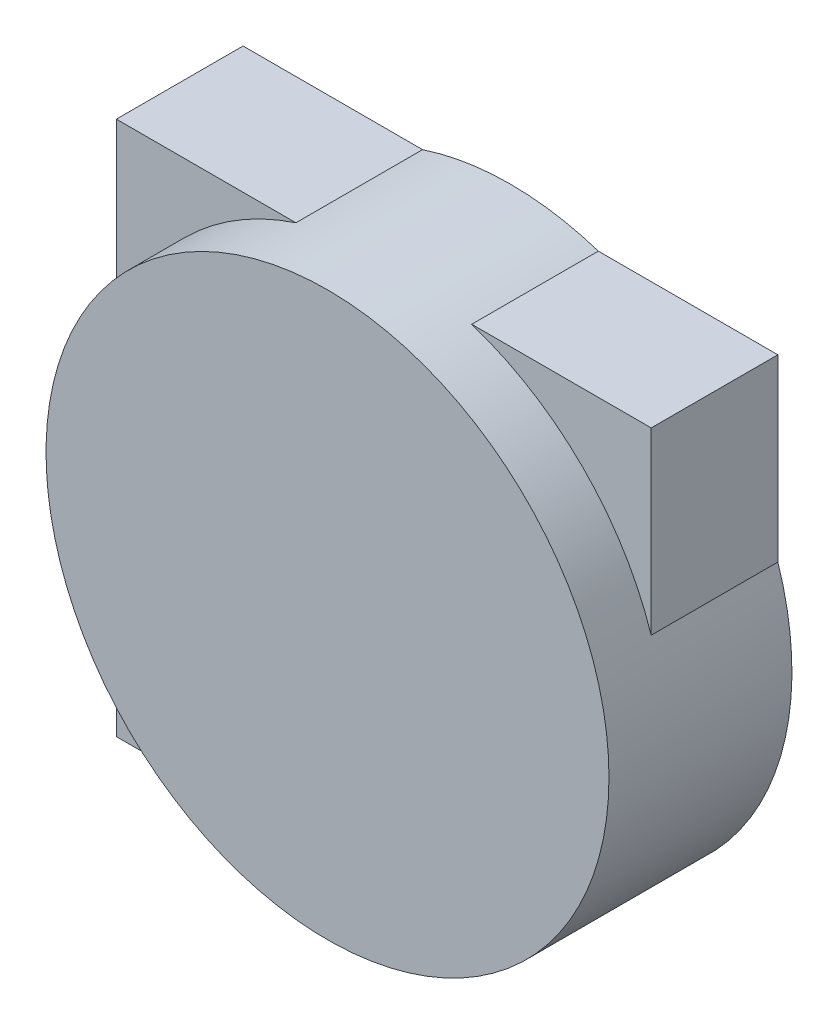
from build123d import *

# Parameters (mm, degrees)
SKETCH1_R           = 20
BOSS_EXTRUDE1_DEPTH = 13
BOSS_EXTRUDE2_DEPTH = 9


with BuildPart() as part:
    # Sketch1 → Boss-Extrude1 (new body)
    with BuildSketch(Plane.XY):
        with Locations(Location((0, 0, 0), (0, 0, 180))):
            Circle(SKETCH1_R)
    extrude(amount=BOSS_EXTRUDE1_DEPTH)

    # Sketch2 → Boss-Extrude2 (add)
    with BuildSketch(Plane(origin=(0, 0, 0), x_dir=(-1, 0, 0), z_dir=(0, 0, -1))):
        with BuildLine():
            Line((-19, 19), (19, 19))
            Line((19, 19), (19, -19))
            Line((19, -19), (-6.244997998, -19))
            ThreePointArc((-6.244997998, -19), (-14.142135624, -14.142135624), (-19, -6.244997998))
            Line((-19, -6.244997998), (-19, 19))
        make_face()
    extrude(amount=-BOSS_EXTRUDE2_DEPTH)


solid = part.part
